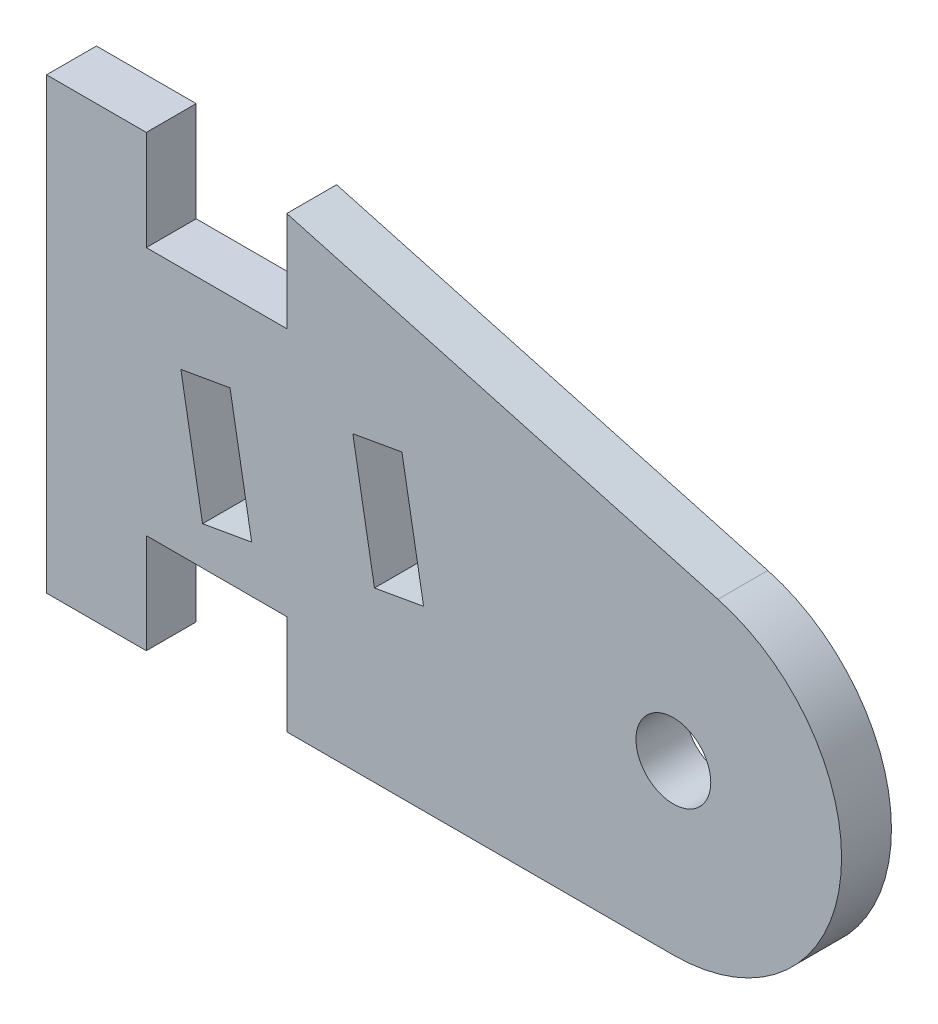
from build123d import *

# Parameters (mm, degrees)
SKETCH1_R           = 1.5
BOSS_EXTRUDE1_DEPTH = 2


with BuildPart() as part:
    # Sketch1 → Boss-Extrude1 (new body)
    with BuildSketch(Plane.XY):
        with BuildLine():
            Line((0, 0), (0, 18))
            Line((0, 18), (4, 17.99998836))
            Line((4, 17.99998836), (3.999996862, 13.99998836))
            Line((3.999996862, 13.99998836), (9.631513212, 13.99998836))
            Line((9.631513212, 13.99998836), (9.631513212, 17.99998836))
            Line((9.631513212, 17.99998836), (26.920387768, 13.248592057))
            ThreePointArc((26.920387768, 13.248592057), (31.81744671, 5.842881132), (25.13296029, -0.000352724))
            Line((25.13296029, -0.000352724), (9.631467627, -0.000352724))
            Line((9.631467627, -0.000352724), (9.631467627, 3.999647276))
            Line((9.631467627, 3.999647276), (4, 3.999647276))
            Line((4, 3.999647276), (4, 0))
            Line((4, 0), (0, 0))
        make_face()
        with Locations((25.13296029, 6.744691419)):
            Circle(SKETCH1_R, mode=Mode.SUBTRACT)
        Polygon((14.250450019, 12.02557168), (12.280834513, 11.678275325), (13.149075402, 6.75423656), (15.118690908, 7.101532915), align=None, mode=Mode.SUBTRACT)
        Polygon((7.356795748, 10.810034437), (8.225036637, 5.885995672), (6.255421131, 5.538699316), (5.387180242, 10.462738081), align=None, mode=Mode.SUBTRACT)
    extrude(amount=BOSS_EXTRUDE1_DEPTH)


solid = part.part
